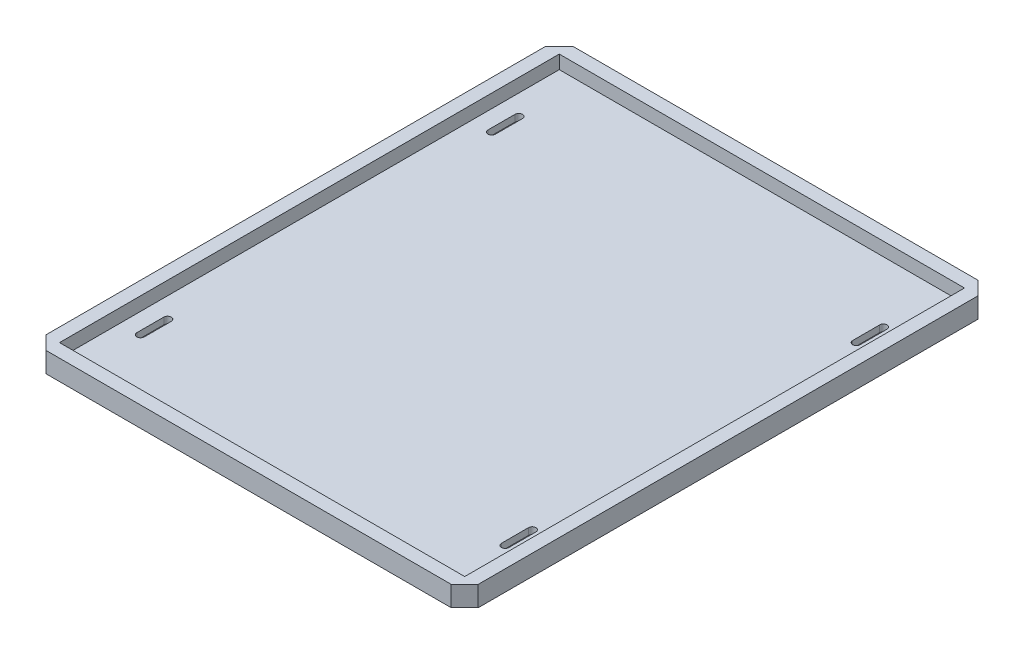
from build123d import *

# Parameters (mm, degrees)
SKETCH_1_W          = 320
SKETCH_1_H          = 390
EXTRUDE_1_DEPTH     = 5
CUT_EXTRUDE_1_DEPTH = 5
SKETCH_3_W          = 320
SKETCH_3_H          = 390
SKETCH_3_W_2        = 300
SKETCH_3_H_2        = 370
EXTRUDE_2_DEPTH     = 15
CHAMFER_1_SIZE      = 10


with BuildPart() as part:
    # 草图1 → 凸台-拉伸1 (new body)
    with BuildSketch(Plane(origin=(0, 0, 0), x_dir=(1, 0, 0), z_dir=(0, 1, 0))):
        Rectangle(SKETCH_1_W, SKETCH_1_H)
    extrude(amount=EXTRUDE_1_DEPTH)

    # 草图2 → 切除-拉伸1 (cut)
    with BuildSketch(Plane(origin=(0, 5, 0), x_dir=(1, 0, 0), z_dir=(0, 1, 0))):
        with BuildLine():
            Line((-132.25, 140), (-132.25, 120))
            ThreePointArc((-132.25, 120), (-135, 117.25), (-137.75, 120))
            Line((-137.75, 120), (-137.75, 140))
            ThreePointArc((-137.75, 140), (-135, 142.75), (-132.25, 140))
        make_face()
        with BuildLine():
            Line((-132.25, -140), (-132.25, -120))
            ThreePointArc((-132.25, -120), (-135, -117.25), (-137.75, -120))
            Line((-137.75, -120), (-137.75, -140))
            ThreePointArc((-137.75, -140), (-135, -142.75), (-132.25, -140))
        make_face()
        with BuildLine():
            Line((132.25, 140), (132.25, 120))
            ThreePointArc((132.25, 120), (135, 117.25), (137.75, 120))
            Line((137.75, 120), (137.75, 140))
            ThreePointArc((137.75, 140), (135, 142.75), (132.25, 140))
        make_face()
        with BuildLine():
            Line((132.25, -140), (132.25, -120))
            ThreePointArc((132.25, -120), (135, -117.25), (137.75, -120))
            Line((137.75, -120), (137.75, -140))
            ThreePointArc((137.75, -140), (135, -142.75), (132.25, -140))
        make_face()
    extrude(amount=-CUT_EXTRUDE_1_DEPTH, mode=Mode.SUBTRACT)

    # 草图3 → 凸台-拉伸2 (add)
    with BuildSketch(Plane(origin=(0, 0, 0), x_dir=(1, 0, 0), z_dir=(0, 1, 0))):
        Rectangle(SKETCH_3_W, SKETCH_3_H)
        Rectangle(SKETCH_3_W_2, SKETCH_3_H_2, mode=Mode.SUBTRACT)
    extrude(amount=EXTRUDE_2_DEPTH)

    # 倒角1
    chamfer_1_edges = [part.edges().sort_by_distance(p)[0] for p in [
        (-160, 7.5, -195),
        (-160, 7.5, 195),
        (160, 7.5, 195),
        (160, 7.5, -195),
    ]]
    chamfer(chamfer_1_edges, length=CHAMFER_1_SIZE)


solid = part.part
